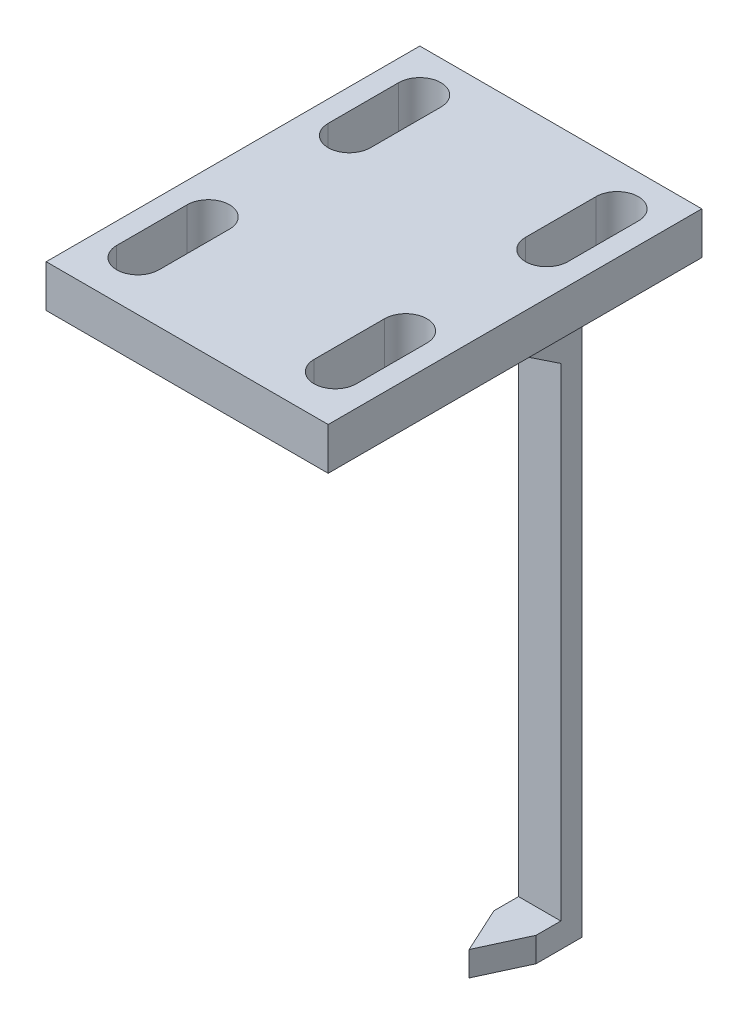
from build123d import *

# Parameters (mm, degrees)
BOSS_EXTRUDE1_DEPTH = 1.5
SKETCH2_W           = 3
SKETCH2_H           = 1.750926398
BOSS_EXTRUDE2_DEPTH = 5
SKETCH3_W           = 20
SKETCH3_H           = 3
BOSS_EXTRUDE3_DEPTH = 25
CUT_EXTRUDE1_DEPTH  = 5
CUT_EXTRUDE2_DEPTH  = 10
BOSS_EXTRUDE4_DEPTH = 3


with BuildPart() as part:
    # Sketch1 → Boss-Extrude1 (new body)
    with BuildSketch(Plane.XY):
        Polygon((3, 46), (11.5, 46), (11.5, 49), (-8.5, 49), (-8.5, 46), (0, 46), (0, 0), (3, 0), align=None)
    extrude(amount=BOSS_EXTRUDE1_DEPTH)

    # Sketch2 → Boss-Extrude2 (add)
    with BuildSketch(Plane.XY.offset(1.5)):
        with Locations((1.5, 0.875463199)):
            Rectangle(SKETCH2_W, SKETCH2_H)
    extrude(amount=BOSS_EXTRUDE2_DEPTH)

    # Sketch3 → Boss-Extrude3 (add)
    with BuildSketch(Plane.XY.offset(1.5)):
        with Locations((1.5, 47.5)):
            Rectangle(SKETCH3_W, SKETCH3_H)
    extrude(amount=BOSS_EXTRUDE3_DEPTH)

    # Sketch4 → Cut-Extrude1 (cut)
    with BuildSketch(Plane.XZ):
        Polygon((1.5, 6.5), (0, 3.25), (-2.721053337, 3.25), (-2.721053337, 9.447530039), (6.003312616, 9.447530039), (5.654337978, 3.25), (3, 3.25), align=None)
    extrude(amount=-CUT_EXTRUDE1_DEPTH, mode=Mode.SUBTRACT)

    # Sketch5 → Cut-Extrude2 (cut)
    with BuildSketch(Plane.XZ.offset(-46)):
        with BuildLine():
            Line((-4, 8), (-4, 3))
            ThreePointArc((-4, 3), (-5.5, 1.5), (-7, 3))
            Line((-7, 3), (-7, 8))
            ThreePointArc((-7, 8), (-5.5, 9.5), (-4, 8))
        make_face()
        with BuildLine():
            Line((10, 8), (10, 3))
            ThreePointArc((10, 3), (8.5, 1.5), (7, 3))
            Line((7, 3), (7, 8))
            ThreePointArc((7, 8), (8.5, 9.5), (10, 8))
        make_face()
        with BuildLine():
            Line((10, 23), (10, 18))
            ThreePointArc((10, 18), (8.5, 16.5), (7, 18))
            Line((7, 18), (7, 23))
            ThreePointArc((7, 23), (8.5, 24.5), (10, 23))
        make_face()
        with BuildLine():
            Line((-4, 23), (-4, 18))
            ThreePointArc((-4, 18), (-5.5, 16.5), (-7, 18))
            Line((-7, 18), (-7, 23))
            ThreePointArc((-7, 23), (-5.5, 24.5), (-4, 23))
        make_face()
    extrude(amount=-CUT_EXTRUDE2_DEPTH, mode=Mode.SUBTRACT)

    # Sketch6 → Boss-Extrude4 (add)
    with BuildSketch(Plane.ZY):
        Polygon((1.5, 46), (16.5, 46), (1.5, 36), align=None)
    extrude(amount=-BOSS_EXTRUDE4_DEPTH)


solid = part.part
